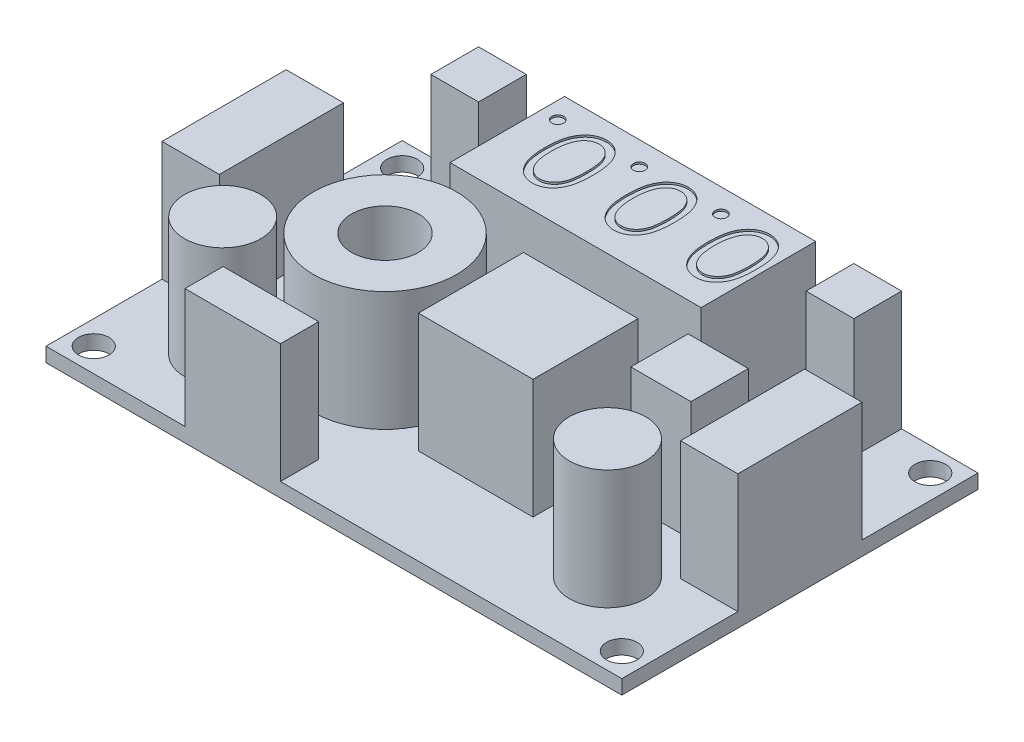
from build123d import *

# Parameters (mm, degrees)
SKETCH_2_W          = 60.3
SKETCH_2_H          = 37.3
EXTRUDE_1_DEPTH     = 1.5
SKETCH_3_R          = 4
SKETCH_3_R_2        = 7.5
SKETCH_3_R_3        = 3.5
SKETCH_3_W          = 6
SKETCH_3_H          = 13
SKETCH_3_W_2        = 10
SKETCH_3_H_2        = 4
SKETCH_3_W_3        = 12
SKETCH_3_H_3        = 11
SKETCH_3_W_4        = 5
SKETCH_3_H_4        = 5
SKETCH_3_W_5        = 26.3
SKETCH_3_H_5        = 12
SKETCH_3_W_6        = 6.3
SKETCH_3_H_6        = 6
EXTRUDE_2_DEPTH     = 12.5
SKETCH_3_2_R        = 4
SKETCH_3_2_R_2      = 7.5
SKETCH_3_2_R_3      = 3.5
SKETCH_3_2_W        = 6
SKETCH_3_2_H        = 13
SKETCH_3_2_W_2      = 10
SKETCH_3_2_H_2      = 4
SKETCH_3_2_W_3      = 12
SKETCH_3_2_H_3      = 11
SKETCH_3_2_W_4      = 5
SKETCH_3_2_H_4      = 5
SKETCH_3_2_W_5      = 26.3
SKETCH_3_2_H_5      = 12
SKETCH_3_2_W_6      = 6.3
SKETCH_3_2_H_6      = 6
EXTRUDE_3_DEPTH     = 8
CUT_EXTRUDE_1_DEPTH = 0.2
SKETCH_6_R          = 1.6
CUT_EXTRUDE_2_DEPTH = 38.591155958


with BuildPart() as part:
    # 스케치2 → 보스-돌출1 (new body)
    with BuildSketch(Plane(origin=(0, 0, 0), x_dir=(1, 0, 0), z_dir=(0, 1, 0))):
        Rectangle(SKETCH_2_W, SKETCH_2_H)
    extrude(amount=EXTRUDE_1_DEPTH)

    # 스케치3 → 보스-돌출2 (add)
    # profile 1 of 11: a face of its own
    with BuildSketch(Plane(origin=(0, 1.5, 0), x_dir=(1, 0, 0), z_dir=(0, 1, 0))):
        with Locations(Location((-20.15, -10.15, 0), (0, 0, 270))):
            Circle(SKETCH_3_R)
    # profile 2 of 11: a face of its own
    with BuildSketch(Plane(origin=(0, 1.5, 0), x_dir=(1, 0, 0), z_dir=(0, 1, 0))):
        with Locations(Location((20.15, -10.15, 0), (0, 0, 270))):
            Circle(SKETCH_3_R)
    # profile 3 of 11: a face of its own
    with BuildSketch(Plane(origin=(0, 1.5, 0), x_dir=(1, 0, 0), z_dir=(0, 1, 0))):
        with Locations(Location((-10.15, -3.15, 0), (0, 0, 270))):
            Circle(SKETCH_3_R_2)
        with Locations(Location((-10.15, -3.15, 0), (0, 0, 270))):
            Circle(SKETCH_3_R_3, mode=Mode.SUBTRACT)
    # profile 4 of 11: a face of its own
    with BuildSketch(Plane(origin=(0, 1.5, 0), x_dir=(1, 0, 0), z_dir=(0, 1, 0))):
        with Locations((-27.15, 0)):
            Rectangle(SKETCH_3_W, SKETCH_3_H)
    # profile 5 of 11: a face of its own
    with BuildSketch(Plane(origin=(0, 1.5, 0), x_dir=(1, 0, 0), z_dir=(0, 1, 0))):
        with Locations((27.15, 0)):
            Rectangle(SKETCH_3_W, SKETCH_3_H)
    # profile 6 of 11: a face of its own
    with BuildSketch(Plane(origin=(0, 1.5, 0), x_dir=(1, 0, 0), z_dir=(0, 1, 0))):
        with Locations((-10.600792866, -16.65)):
            Rectangle(SKETCH_3_W_2, SKETCH_3_H_2)
    # profile 7 of 11: a face of its own
    with BuildSketch(Plane(origin=(0, 1.5, 0), x_dir=(1, 0, 0), z_dir=(0, 1, 0))):
        with Locations((4.85, -3.15)):
            Rectangle(SKETCH_3_W_3, SKETCH_3_H_3)
    # profile 8 of 11: a face of its own
    with BuildSketch(Plane(origin=(0, 1.5, 0), x_dir=(1, 0, 0), z_dir=(0, 1, 0))):
        with Locations((-19.65, 16.15)):
            Rectangle(SKETCH_3_W_4, SKETCH_3_H_4)
    # profile 9 of 11: a face of its own
    with BuildSketch(Plane(origin=(0, 1.5, 0), x_dir=(1, 0, 0), z_dir=(0, 1, 0))):
        with Locations((19.65, 16.15)):
            Rectangle(SKETCH_3_W_4, SKETCH_3_H_4)
    # profile 10 of 11: a face of its own
    with BuildSketch(Plane(origin=(0, 1.5, 0), x_dir=(1, 0, 0), z_dir=(0, 1, 0))):
        with Locations((0, 12.65)):
            Rectangle(SKETCH_3_W_5, SKETCH_3_H_5)
    # profile 11 of 11: a face of its own
    with BuildSketch(Plane(origin=(0, 1.5, 0), x_dir=(1, 0, 0), z_dir=(0, 1, 0))):
        with Locations((18, 0.591539158)):
            Rectangle(SKETCH_3_W_6, SKETCH_3_H_6)
    extrude(amount=EXTRUDE_2_DEPTH)

    # 스케치3<2> → 보스-돌출3 (add)
    # profile 1 of 11: a face of its own
    with BuildSketch(Plane(origin=(0, 1.5, 0), x_dir=(1, 0, 0), z_dir=(0, 1, 0))):
        with Locations(Location((-20.15, -10.15, 0), (0, 0, 270))):
            Circle(SKETCH_3_2_R)
    # profile 2 of 11: a face of its own
    with BuildSketch(Plane(origin=(0, 1.5, 0), x_dir=(1, 0, 0), z_dir=(0, 1, 0))):
        with Locations(Location((20.15, -10.15, 0), (0, 0, 270))):
            Circle(SKETCH_3_2_R)
    # profile 3 of 11: a face of its own
    with BuildSketch(Plane(origin=(0, 1.5, 0), x_dir=(1, 0, 0), z_dir=(0, 1, 0))):
        with Locations(Location((-10.15, -3.15, 0), (0, 0, 270))):
            Circle(SKETCH_3_2_R_2)
        with Locations(Location((-10.15, -3.15, 0), (0, 0, 270))):
            Circle(SKETCH_3_2_R_3, mode=Mode.SUBTRACT)
    # profile 4 of 11: a face of its own
    with BuildSketch(Plane(origin=(0, 1.5, 0), x_dir=(1, 0, 0), z_dir=(0, 1, 0))):
        with Locations((-27.15, 0)):
            Rectangle(SKETCH_3_2_W, SKETCH_3_2_H)
    # profile 5 of 11: a face of its own
    with BuildSketch(Plane(origin=(0, 1.5, 0), x_dir=(1, 0, 0), z_dir=(0, 1, 0))):
        with Locations((27.15, 0)):
            Rectangle(SKETCH_3_2_W, SKETCH_3_2_H)
    # profile 6 of 11: a face of its own
    with BuildSketch(Plane(origin=(0, 1.5, 0), x_dir=(1, 0, 0), z_dir=(0, 1, 0))):
        with Locations((-10.600792866, -16.65)):
            Rectangle(SKETCH_3_2_W_2, SKETCH_3_2_H_2)
    # profile 7 of 11: a face of its own
    with BuildSketch(Plane(origin=(0, 1.5, 0), x_dir=(1, 0, 0), z_dir=(0, 1, 0))):
        with Locations((4.85, -3.15)):
            Rectangle(SKETCH_3_2_W_3, SKETCH_3_2_H_3)
    # profile 8 of 11: a face of its own
    with BuildSketch(Plane(origin=(0, 1.5, 0), x_dir=(1, 0, 0), z_dir=(0, 1, 0))):
        with Locations((-19.65, 16.15)):
            Rectangle(SKETCH_3_2_W_4, SKETCH_3_2_H_4)
    # profile 9 of 11: a face of its own
    with BuildSketch(Plane(origin=(0, 1.5, 0), x_dir=(1, 0, 0), z_dir=(0, 1, 0))):
        with Locations((19.65, 16.15)):
            Rectangle(SKETCH_3_2_W_4, SKETCH_3_2_H_4)
    # profile 10 of 11: a face of its own
    with BuildSketch(Plane(origin=(0, 1.5, 0), x_dir=(1, 0, 0), z_dir=(0, 1, 0))):
        with Locations((0, 12.65)):
            Rectangle(SKETCH_3_2_W_5, SKETCH_3_2_H_5)
    # profile 11 of 11: a face of its own
    with BuildSketch(Plane(origin=(0, 1.5, 0), x_dir=(1, 0, 0), z_dir=(0, 1, 0))):
        with Locations((18, 0.591539158)):
            Rectangle(SKETCH_3_2_W_6, SKETCH_3_2_H_6)
    extrude(amount=EXTRUDE_3_DEPTH)

    # 스케치5 → 컷-돌출1 (cut)
    # profile 1 of 6: a face of its own
    with BuildSketch(Plane(origin=(0, 14, 0), x_dir=(1, 0, 0), z_dir=(0, 1, 0))):
        with BuildLine():
            add(Edge.make_bspline(
                [(-11.397435897, 15.567123363), (-11.438718733, 15.569493808), (-11.519173103, 15.574113469), (-11.635673463, 15.608065675), (-11.742133764, 15.66535282), (-11.836376857, 15.744065944), (-11.914704943, 15.838038705), (-11.972651259, 15.944228568), (-12.008159739, 16.061066679), (-12.012548898, 16.142681621), (-12.014797009, 16.184484474)],
                knots=[0, 0, 0, 0, 1.020591893, 1.988988293, 2.974634352, 3.991697318, 5.008760285, 5.983632262, 6.967224335, 8, 8, 8, 8], degree=3))
            add(Edge.make_bspline(
                [(-12.014797009, 16.184484474), (-12.012466937, 16.225289178), (-12.007864137, 16.305894365), (-11.972634617, 16.42174672), (-11.91477841, 16.528057141), (-11.835880878, 16.621807527), (-11.742703221, 16.702415061), (-11.63533597, 16.758907344), (-11.519473472, 16.795347589), (-11.438772871, 16.799644562), (-11.397435897, 16.801845585)],
                knots=[0, 0, 0, 0, 1.010056097, 1.99525427, 2.971718109, 3.990441831, 5.01702829, 6.004283803, 6.977741589, 8, 8, 8, 8], degree=3))
            add(Edge.make_bspline(
                [(-11.397435897, 16.801845585), (-11.356128673, 16.799561654), (-11.275011747, 16.795076592), (-11.15871567, 16.759631815), (-11.051998863, 16.701863814), (-10.958796985, 16.621953), (-10.88053367, 16.527568928), (-10.819991473, 16.422470523), (-10.787572789, 16.305559314), (-10.78259768, 16.225223181), (-10.780074786, 16.184484474)],
                knots=[0, 0, 0, 0, 1.021821805, 2.006599202, 2.982645994, 4.008793999, 5.027082625, 6.009034913, 6.990375297, 8, 8, 8, 8], degree=3))
            add(Edge.make_bspline(
                [(-10.780074786, 16.184484474), (-10.782522528, 16.142749951), (-10.787293308, 16.061407139), (-10.819976727, 15.943505435), (-10.880607272, 15.838527428), (-10.958302648, 15.743921608), (-11.052562566, 15.665895393), (-11.158384596, 15.607351229), (-11.275307417, 15.574380603), (-11.356181615, 15.569574816), (-11.397435897, 15.567123363)],
                knots=[0, 0, 0, 0, 1.032329927, 2.012066096, 2.992413168, 4.009037178, 5.025661188, 6.000112418, 6.979848586, 8, 8, 8, 8], degree=3))
        make_face()
    # profile 2 of 6: a face of its own
    with BuildSketch(Plane(origin=(0, 14, 0), x_dir=(1, 0, 0), z_dir=(0, 1, 0))):
        with BuildLine():
            add(Edge.make_bspline(
                [(-4.511485043, 13.005668368), (-4.512179348, 12.886928898), (-4.513528045, 12.656275764), (-4.52853187, 12.320181606), (-4.553456343, 12.004882325), (-4.587613789, 11.710362842), (-4.629180824, 11.436547086), (-4.684670348, 11.184166923), (-4.747773855, 10.952053844), (-4.820910734, 10.739452331), (-4.903431896, 10.543493358), (-4.99326163, 10.360570013), (-5.093903041, 10.190900808), (-5.199821224, 10.031985876), (-5.31472312, 9.885424488), (-5.438209155, 9.751875318), (-5.569191654, 9.629268823), (-5.708290392, 9.51962111), (-5.854179582, 9.424077754), (-6.002543632, 9.337469863), (-6.15761419, 9.268960632), (-6.315566354, 9.210377348), (-6.477672711, 9.163971471), (-6.644003878, 9.13169254), (-6.814709112, 9.111498155), (-6.929920357, 9.109559528), (-6.988349693, 9.108576354)],
                knots=[0, 0, 0, 0, 1.64625301, 3.197870201, 4.6634513, 6.030635694, 7.308242971, 8.501545196, 9.611429483, 10.641742253, 11.616230371, 12.55791849, 13.464870342, 14.34944951, 15.20427819, 16.044004467, 16.869007726, 17.689551165, 18.496129964, 19.285613293, 20.0683943, 20.843080271, 21.620342827, 22.403213977, 23.190190624, 24, 24, 24, 24], degree=3))
            add(Edge.make_bspline(
                [(-6.988349693, 9.108576354), (-7.047296696, 9.109393917), (-7.164580485, 9.111020578), (-7.337353715, 9.133916813), (-7.507117531, 9.163469646), (-7.671296279, 9.210867523), (-7.832994264, 9.26758523), (-7.988190382, 9.342423343), (-8.142363877, 9.423815603), (-8.288510853, 9.523107313), (-8.430997914, 9.632840993), (-8.564564657, 9.757416773), (-8.692625405, 9.893387006), (-8.810343354, 10.043784224), (-8.92276373, 10.206302392), (-9.025618944, 10.382303882), (-9.121048196, 10.571398649), (-9.210845303, 10.772710077), (-9.289370501, 10.991615508), (-9.35918568, 11.226749571), (-9.416411032, 11.480241516), (-9.463735392, 11.750679235), (-9.500468104, 12.039402471), (-9.52720155, 12.345826237), (-9.541327853, 12.670142238), (-9.543987644, 12.891879755), (-9.545352564, 13.005668368)],
                knots=[0, 0, 0, 0, 0.810910589, 1.61342667, 2.396193133, 3.181089899, 3.963115317, 4.752255436, 5.550715454, 6.36105385, 7.181178335, 8.024612154, 8.872680183, 9.750181803, 10.651284446, 11.591556747, 12.554036451, 13.566402641, 14.62422919, 15.753422176, 16.94128843, 18.199818041, 19.531985927, 20.947085226, 22.433341622, 24, 24, 24, 24], degree=3))
            add(Edge.make_bspline(
                [(-9.545352564, 13.005668368), (-9.543955916, 13.118959227), (-9.541228512, 13.340195966), (-9.527523045, 13.663073753), (-9.499751468, 13.967825443), (-9.465902937, 14.254892564), (-9.417099978, 14.523899873), (-9.362767702, 14.776292038), (-9.293463834, 15.009697534), (-9.216801235, 15.226726558), (-9.128253594, 15.427185214), (-9.033543039, 15.615499459), (-8.92915243, 15.790502101), (-8.818889194, 15.954050393), (-8.69894261, 16.103157767), (-8.572614906, 16.24064899), (-8.437752358, 16.365441205), (-8.294531811, 16.476470544), (-8.147003483, 16.57651021), (-7.992799932, 16.660804671), (-7.83553092, 16.734292239), (-7.673560648, 16.793367649), (-7.507921951, 16.840066993), (-7.338018337, 16.871857331), (-7.164557379, 16.894265516), (-7.047288967, 16.895968364), (-6.988349693, 16.896824218)],
                knots=[0, 0, 0, 0, 1.561431216, 3.049195289, 4.452146966, 5.778046447, 7.031138842, 8.218704273, 9.334037798, 10.384210803, 11.388620812, 12.352076869, 13.287433199, 14.19507451, 15.06813243, 15.922055533, 16.766344942, 17.596869952, 18.417486629, 19.220035357, 20.016159057, 20.807716045, 21.59340902, 22.384936649, 23.188266813, 24, 24, 24, 24], degree=3))
            add(Edge.make_bspline(
                [(-6.988349693, 16.896824218), (-6.929922394, 16.895832331), (-6.814715164, 16.893876523), (-6.643980515, 16.873807995), (-6.47789052, 16.841082987), (-6.316113144, 16.796642595), (-6.158317344, 16.740161468), (-6.006048736, 16.668319654), (-5.857296952, 16.584994007), (-5.712738563, 16.490196696), (-5.575137093, 16.381556838), (-5.443672279, 16.261421803), (-5.321785121, 16.126695577), (-5.207675633, 15.979528498), (-5.100878616, 15.820213524), (-5.000663394, 15.649245411), (-4.911107222, 15.464540078), (-4.82671499, 15.267517329), (-4.752322593, 15.053353675), (-4.687364526, 14.820445179), (-4.632598964, 14.567203187), (-4.58897743, 14.293615578), (-4.553241666, 14.000105883), (-4.528556442, 13.68620638), (-4.513535547, 13.352589412), (-4.512181017, 13.123418955), (-4.511485043, 13.005668368)],
                knots=[0, 0, 0, 0, 0.810976328, 1.599087026, 2.383086309, 3.159618043, 3.926613167, 4.707144544, 5.494386734, 6.292609454, 7.104690378, 7.92621526, 8.762510248, 9.62398222, 10.509836085, 11.424023232, 12.373226806, 13.358118208, 14.398657954, 15.5185989, 16.713620699, 17.994156382, 19.364120462, 20.818119981, 22.365111093, 24, 24, 24, 24], degree=3))
        make_face()
        with BuildLine():
            add(Edge.make_bspline(
                [(-5.17633547, 13.002700286), (-5.176593844, 13.101651303), (-5.177095296, 13.293695797), (-5.189816267, 13.572276274), (-5.20752256, 13.832544853), (-5.229798103, 14.074399947), (-5.263158868, 14.296996307), (-5.301008783, 14.50125925), (-5.346407151, 14.686811016), (-5.400387401, 14.855272018), (-5.461872912, 15.009031402), (-5.528897572, 15.152174703), (-5.601499765, 15.286443046), (-5.6813452, 15.411351992), (-5.769577835, 15.526203894), (-5.864228287, 15.631544221), (-5.965846918, 15.726944058), (-6.106486901, 15.840164333), (-6.291254673, 15.958540207), (-6.525244582, 16.060354708), (-6.76578574, 16.124752199), (-6.929096731, 16.132918903), (-7.01061031, 16.136995158)],
                knots=[0, 0, 0, 0, 1.459193451, 2.832007961, 4.111736495, 5.306635028, 6.412683014, 7.430020708, 8.369596877, 9.227877302, 10.036669781, 10.810175692, 11.557788084, 12.286326232, 12.994037279, 13.69140682, 14.37267704, 15.047194847, 16.352618509, 17.594157723, 18.799169539, 20, 20, 20, 20], degree=3))
            add(Edge.make_bspline(
                [(-7.01061031, 16.136995158), (-7.092591953, 16.13342084), (-7.256264433, 16.126284884), (-7.496641864, 16.064005072), (-7.72807076, 15.962757874), (-7.910711992, 15.847085351), (-8.04927661, 15.736221351), (-8.148592504, 15.641808112), (-8.239738209, 15.536062328), (-8.326187906, 15.421977114), (-8.405476105, 15.297363236), (-8.477576464, 15.162822581), (-8.543369535, 15.017980785), (-8.580853685, 14.916868175), (-8.600018363, 14.865171907)],
                knots=[0, 0, 0, 0, 1.353621445, 2.702441307, 4.075953605, 5.516772412, 6.261413105, 7.007624062, 7.778524365, 8.566925914, 9.372323995, 10.217594641, 11.088702136, 12, 12, 12, 12], degree=3))
            add(Edge.make_bspline(
                [(-8.600018363, 14.865171907), (-8.622352938, 14.799068959), (-8.667701704, 14.664851625), (-8.726146626, 14.456648561), (-8.772174388, 14.238202711), (-8.813583512, 14.010819547), (-8.84184748, 13.77282218), (-8.864597018, 13.524947), (-8.877996972, 13.267007117), (-8.879658029, 13.091757719), (-8.880502137, 13.002700286)],
                knots=[0, 0, 0, 0, 0.884706709, 1.796334032, 2.740027952, 3.714592787, 4.726048262, 5.777819803, 6.87074269, 8, 8, 8, 8], degree=3))
            add(Edge.make_bspline(
                [(-8.880502137, 13.002700286), (-8.879571176, 12.913644767), (-8.877749792, 12.739411585), (-8.865783136, 12.484508282), (-8.846553716, 12.241982008), (-8.820527114, 12.011612753), (-8.784798102, 11.793810539), (-8.741891091, 11.588263725), (-8.691587622, 11.395027623), (-8.633887774, 11.213604239), (-8.568861774, 11.044644461), (-8.497024343, 10.887784576), (-8.420375131, 10.742178564), (-8.337068168, 10.608294758), (-8.248282107, 10.485351939), (-8.150828953, 10.376180172), (-8.050898853, 10.275468557), (-7.908777103, 10.162563418), (-7.724227713, 10.046534744), (-7.493001864, 9.942662738), (-7.253693081, 9.881188482), (-7.091579476, 9.872663365), (-7.01061031, 9.868405414)],
                knots=[0, 0, 0, 0, 1.313528337, 2.569860077, 3.762944266, 4.901481389, 5.988248151, 7.017139294, 7.997571128, 8.932104357, 9.823695246, 10.66607014, 11.475539426, 12.248954257, 12.990316782, 13.708962568, 14.405488541, 15.08007697, 16.381737273, 17.610043218, 18.806313575, 20, 20, 20, 20], degree=3))
            add(Edge.make_bspline(
                [(-7.01061031, 9.868405414), (-6.928656998, 9.872668403), (-6.764601074, 9.881202146), (-6.522788848, 9.942445847), (-6.290178777, 10.045795973), (-6.106018292, 10.162706896), (-5.965897328, 10.275030083), (-5.866184747, 10.370895547), (-5.772082094, 10.475250722), (-5.684272141, 10.589581882), (-5.604913867, 10.714252649), (-5.53142926, 10.847547626), (-5.464939343, 10.990478291), (-5.403221748, 11.144152694), (-5.349814258, 11.312890509), (-5.301794699, 11.49840527), (-5.264730824, 11.703996623), (-5.231821361, 11.927638296), (-5.206945548, 12.169780938), (-5.18993967, 12.430665636), (-5.177056659, 12.710217225), (-5.176580681, 12.903253253), (-5.17633547, 13.002700286)],
                knots=[0, 0, 0, 0, 1.207779899, 2.417760083, 3.652287919, 4.947299644, 5.621638849, 6.297435916, 6.984320042, 7.691843698, 8.42018894, 9.161205785, 9.934506883, 10.743085206, 11.601138371, 12.542248028, 13.566483018, 14.679455109, 15.87477181, 17.154161492, 18.533899613, 20, 20, 20, 20], degree=3))
        make_face(mode=Mode.SUBTRACT)
    # profile 3 of 6: a face of its own
    with BuildSketch(Plane(origin=(0, 14, 0), x_dir=(1, 0, 0), z_dir=(0, 1, 0))):
        with BuildLine():
            add(Edge.make_bspline(
                [(-2.849358974, 15.567123363), (-2.89064181, 15.569493808), (-2.97109618, 15.574113469), (-3.08759654, 15.608065675), (-3.194056841, 15.66535282), (-3.288299934, 15.744065944), (-3.36662802, 15.838038705), (-3.424574335, 15.944228568), (-3.460082816, 16.061066679), (-3.464471975, 16.142681621), (-3.466720085, 16.184484474)],
                knots=[0, 0, 0, 0, 1.020591893, 1.988988293, 2.974634352, 3.991697318, 5.008760285, 5.983632262, 6.967224335, 8, 8, 8, 8], degree=3))
            add(Edge.make_bspline(
                [(-3.466720085, 16.184484474), (-3.464390014, 16.225289178), (-3.459787214, 16.305894365), (-3.424557694, 16.42174672), (-3.366701487, 16.528057141), (-3.287803955, 16.621807527), (-3.194626298, 16.702415061), (-3.087259047, 16.758907344), (-2.971396549, 16.795347589), (-2.890695948, 16.799644562), (-2.849358974, 16.801845585)],
                knots=[0, 0, 0, 0, 1.010056097, 1.99525427, 2.971718109, 3.990441831, 5.01702829, 6.004283803, 6.977741589, 8, 8, 8, 8], degree=3))
            add(Edge.make_bspline(
                [(-2.849358974, 16.801845585), (-2.80805175, 16.799561654), (-2.726934824, 16.795076592), (-2.610638747, 16.759631815), (-2.503921939, 16.701863814), (-2.410720062, 16.621953), (-2.332456747, 16.527568928), (-2.27191455, 16.422470523), (-2.239495866, 16.305559314), (-2.234520757, 16.225223181), (-2.231997863, 16.184484474)],
                knots=[0, 0, 0, 0, 1.021821805, 2.006599202, 2.982645994, 4.008793999, 5.027082625, 6.009034913, 6.990375297, 8, 8, 8, 8], degree=3))
            add(Edge.make_bspline(
                [(-2.231997863, 16.184484474), (-2.234445605, 16.142749951), (-2.239216385, 16.061407139), (-2.271899804, 15.943505435), (-2.332530349, 15.838527428), (-2.410225725, 15.743921608), (-2.504485643, 15.665895393), (-2.610307673, 15.607351229), (-2.727230494, 15.574380603), (-2.808104692, 15.569574816), (-2.849358974, 15.567123363)],
                knots=[0, 0, 0, 0, 1.032329927, 2.012066096, 2.992413168, 4.009037178, 5.025661188, 6.000112418, 6.979848586, 8, 8, 8, 8], degree=3))
        make_face()
    # profile 4 of 6: a face of its own
    with BuildSketch(Plane(origin=(0, 14, 0), x_dir=(1, 0, 0), z_dir=(0, 1, 0))):
        with BuildLine():
            add(Edge.make_bspline(
                [(4.03659188, 13.005668368), (4.035897575, 12.886928898), (4.034548878, 12.656275764), (4.019545053, 12.320181606), (3.99462058, 12.004882325), (3.960463134, 11.710362842), (3.918896099, 11.436547086), (3.863406575, 11.184166923), (3.800303068, 10.952053844), (3.727166189, 10.739452331), (3.644645027, 10.543493358), (3.554815293, 10.360570013), (3.454173882, 10.190900808), (3.348255699, 10.031985876), (3.233353803, 9.885424488), (3.109867768, 9.751875318), (2.978885269, 9.629268823), (2.839786531, 9.51962111), (2.693897341, 9.424077754), (2.545533291, 9.337469863), (2.390462733, 9.268960632), (2.232510569, 9.210377348), (2.070404212, 9.163971471), (1.904073045, 9.13169254), (1.733367811, 9.111498155), (1.618156566, 9.109559528), (1.55972723, 9.108576354)],
                knots=[0, 0, 0, 0, 1.64625301, 3.197870201, 4.6634513, 6.030635694, 7.308242971, 8.501545196, 9.611429483, 10.641742253, 11.616230371, 12.55791849, 13.464870342, 14.34944951, 15.20427819, 16.044004467, 16.869007726, 17.689551165, 18.496129964, 19.285613293, 20.0683943, 20.843080271, 21.620342827, 22.403213977, 23.190190624, 24, 24, 24, 24], degree=3))
            add(Edge.make_bspline(
                [(1.55972723, 9.108576354), (1.500780227, 9.109393917), (1.383496438, 9.111020578), (1.210723208, 9.133916813), (1.040959392, 9.163469646), (0.876780644, 9.210867523), (0.715082659, 9.26758523), (0.559886541, 9.342423343), (0.405713046, 9.423815603), (0.25956607, 9.523107313), (0.117079009, 9.632840993), (-0.016487734, 9.757416773), (-0.144548482, 9.893387006), (-0.262266431, 10.043784224), (-0.374686807, 10.206302392), (-0.477542021, 10.382303882), (-0.572971273, 10.571398649), (-0.66276838, 10.772710077), (-0.741293578, 10.991615508), (-0.811108757, 11.226749571), (-0.868334109, 11.480241516), (-0.915658469, 11.750679235), (-0.952391181, 12.039402471), (-0.979124627, 12.345826237), (-0.99325093, 12.670142238), (-0.995910721, 12.891879755), (-0.997275641, 13.005668368)],
                knots=[0, 0, 0, 0, 0.810910589, 1.61342667, 2.396193133, 3.181089899, 3.963115317, 4.752255436, 5.550715454, 6.36105385, 7.181178335, 8.024612154, 8.872680183, 9.750181803, 10.651284446, 11.591556747, 12.554036451, 13.566402641, 14.62422919, 15.753422176, 16.94128843, 18.199818041, 19.531985927, 20.947085226, 22.433341622, 24, 24, 24, 24], degree=3))
            add(Edge.make_bspline(
                [(-0.997275641, 13.005668368), (-0.995878993, 13.118959227), (-0.993151589, 13.340195966), (-0.979446122, 13.663073753), (-0.951674545, 13.967825443), (-0.917826014, 14.254892564), (-0.869023055, 14.523899873), (-0.814690779, 14.776292038), (-0.745386911, 15.009697534), (-0.668724312, 15.226726558), (-0.580176671, 15.427185214), (-0.485466116, 15.615499459), (-0.381075507, 15.790502101), (-0.270812271, 15.954050393), (-0.150865687, 16.103157767), (-0.024537983, 16.24064899), (0.110324565, 16.365441205), (0.253545112, 16.476470544), (0.401073441, 16.57651021), (0.555276991, 16.660804671), (0.712546003, 16.734292239), (0.874516275, 16.793367649), (1.040154972, 16.840066993), (1.210058586, 16.871857331), (1.383519544, 16.894265516), (1.500787956, 16.895968364), (1.55972723, 16.896824218)],
                knots=[0, 0, 0, 0, 1.561431216, 3.049195289, 4.452146966, 5.778046447, 7.031138842, 8.218704273, 9.334037798, 10.384210803, 11.388620812, 12.352076869, 13.287433199, 14.19507451, 15.06813243, 15.922055533, 16.766344942, 17.596869952, 18.417486629, 19.220035357, 20.016159057, 20.807716045, 21.59340902, 22.384936649, 23.188266813, 24, 24, 24, 24], degree=3))
            add(Edge.make_bspline(
                [(1.55972723, 16.896824218), (1.618154529, 16.895832331), (1.733361759, 16.893876523), (1.904096408, 16.873807995), (2.070186403, 16.841082987), (2.231963779, 16.796642595), (2.389759579, 16.740161468), (2.542028187, 16.668319654), (2.690779971, 16.584994007), (2.83533836, 16.490196696), (2.97293983, 16.381556838), (3.104404644, 16.261421803), (3.226291802, 16.126695577), (3.34040129, 15.979528498), (3.447198307, 15.820213524), (3.547413529, 15.649245411), (3.636969701, 15.464540078), (3.721361933, 15.267517329), (3.79575433, 15.053353675), (3.860712398, 14.820445179), (3.915477959, 14.567203187), (3.959099493, 14.293615578), (3.994835257, 14.000105883), (4.019520482, 13.68620638), (4.034541376, 13.352589412), (4.035895906, 13.123418955), (4.03659188, 13.005668368)],
                knots=[0, 0, 0, 0, 0.810976328, 1.599087026, 2.383086309, 3.159618043, 3.926613167, 4.707144544, 5.494386734, 6.292609454, 7.104690378, 7.92621526, 8.762510248, 9.62398222, 10.509836085, 11.424023232, 12.373226806, 13.358118208, 14.398657954, 15.5185989, 16.713620699, 17.994156382, 19.364120462, 20.818119981, 22.365111093, 24, 24, 24, 24], degree=3))
        make_face()
        with BuildLine():
            add(Edge.make_bspline(
                [(3.371741453, 13.002700286), (3.371483079, 13.101651303), (3.370981627, 13.293695797), (3.358260656, 13.572276274), (3.340554363, 13.832544853), (3.31827882, 14.074399947), (3.284918056, 14.296996307), (3.247068141, 14.50125925), (3.201669772, 14.686811016), (3.147689522, 14.855272018), (3.086204011, 15.009031402), (3.019179351, 15.152174703), (2.946577158, 15.286443046), (2.866731723, 15.411351992), (2.778499088, 15.526203894), (2.683848636, 15.631544221), (2.582230005, 15.726944058), (2.441590022, 15.840164333), (2.25682225, 15.958540207), (2.022832342, 16.060354708), (1.782291183, 16.124752199), (1.618980192, 16.132918903), (1.537466613, 16.136995158)],
                knots=[0, 0, 0, 0, 1.459193451, 2.832007961, 4.111736495, 5.306635028, 6.412683014, 7.430020708, 8.369596877, 9.227877302, 10.036669781, 10.810175692, 11.557788084, 12.286326232, 12.994037279, 13.69140682, 14.37267704, 15.047194847, 16.352618509, 17.594157723, 18.799169539, 20, 20, 20, 20], degree=3))
            add(Edge.make_bspline(
                [(1.537466613, 16.136995158), (1.45548497, 16.13342084), (1.29181249, 16.126284884), (1.051435059, 16.064005072), (0.820006163, 15.962757874), (0.637364932, 15.847085351), (0.498800313, 15.736221351), (0.399484419, 15.641808112), (0.308338714, 15.536062328), (0.221889017, 15.421977114), (0.142600818, 15.297363236), (0.070500459, 15.162822581), (0.004707388, 15.017980785), (-0.032776761, 14.916868175), (-0.05194144, 14.865171907)],
                knots=[0, 0, 0, 0, 1.353621445, 2.702441307, 4.075953605, 5.516772412, 6.261413105, 7.007624062, 7.778524365, 8.566925914, 9.372323995, 10.217594641, 11.088702136, 12, 12, 12, 12], degree=3))
            add(Edge.make_bspline(
                [(-0.05194144, 14.865171907), (-0.074276015, 14.799068959), (-0.119624781, 14.664851625), (-0.178069703, 14.456648561), (-0.224097465, 14.238202711), (-0.265506589, 14.010819547), (-0.293770557, 13.77282218), (-0.316520095, 13.524947), (-0.329920049, 13.267007117), (-0.331581106, 13.091757719), (-0.332425214, 13.002700286)],
                knots=[0, 0, 0, 0, 0.884706709, 1.796334032, 2.740027952, 3.714592787, 4.726048262, 5.777819803, 6.87074269, 8, 8, 8, 8], degree=3))
            add(Edge.make_bspline(
                [(-0.332425214, 13.002700286), (-0.331494253, 12.913644767), (-0.329672869, 12.739411585), (-0.317706213, 12.484508282), (-0.298476792, 12.241982008), (-0.272450191, 12.011612753), (-0.236721179, 11.793810539), (-0.193814168, 11.588263725), (-0.143510699, 11.395027623), (-0.085810851, 11.213604239), (-0.020784851, 11.044644461), (0.05105258, 10.887784576), (0.127701792, 10.742178564), (0.211008755, 10.608294758), (0.299794816, 10.485351939), (0.39724797, 10.376180172), (0.49717807, 10.275468557), (0.63929982, 10.162563418), (0.82384921, 10.046534744), (1.055075059, 9.942662738), (1.294383843, 9.881188482), (1.456497447, 9.872663365), (1.537466613, 9.868405414)],
                knots=[0, 0, 0, 0, 1.313528337, 2.569860077, 3.762944266, 4.901481389, 5.988248151, 7.017139294, 7.997571128, 8.932104357, 9.823695246, 10.66607014, 11.475539426, 12.248954257, 12.990316782, 13.708962568, 14.405488541, 15.08007697, 16.381737273, 17.610043218, 18.806313575, 20, 20, 20, 20], degree=3))
            add(Edge.make_bspline(
                [(1.537466613, 9.868405414), (1.619419925, 9.872668403), (1.783475849, 9.881202146), (2.025288075, 9.942445847), (2.257898146, 10.045795973), (2.442058631, 10.162706896), (2.582179595, 10.275030083), (2.681892176, 10.370895547), (2.775994829, 10.475250722), (2.863804782, 10.589581882), (2.943163056, 10.714252649), (3.016647663, 10.847547626), (3.08313758, 10.990478291), (3.144855175, 11.144152694), (3.198262665, 11.312890509), (3.246282224, 11.49840527), (3.283346099, 11.703996623), (3.316255562, 11.927638296), (3.341131375, 12.169780938), (3.358137253, 12.430665636), (3.371020264, 12.710217225), (3.371496242, 12.903253253), (3.371741453, 13.002700286)],
                knots=[0, 0, 0, 0, 1.207779899, 2.417760083, 3.652287919, 4.947299644, 5.621638849, 6.297435916, 6.984320042, 7.691843698, 8.42018894, 9.161205785, 9.934506883, 10.743085206, 11.601138371, 12.542248028, 13.566483018, 14.679455109, 15.87477181, 17.154161492, 18.533899613, 20, 20, 20, 20], degree=3))
        make_face(mode=Mode.SUBTRACT)
    # profile 5 of 6: a face of its own
    with BuildSketch(Plane(origin=(0, 14, 0), x_dir=(1, 0, 0), z_dir=(0, 1, 0))):
        with BuildLine():
            add(Edge.make_bspline(
                [(5.698717949, 15.567123363), (5.657435113, 15.569493808), (5.576980743, 15.574113469), (5.460480383, 15.608065675), (5.354020082, 15.66535282), (5.259776989, 15.744065944), (5.181448903, 15.838038705), (5.123502588, 15.944228568), (5.087994107, 16.061066679), (5.083604948, 16.142681621), (5.081356838, 16.184484474)],
                knots=[0, 0, 0, 0, 1.020591893, 1.988988293, 2.974634352, 3.991697318, 5.008760285, 5.983632262, 6.967224335, 8, 8, 8, 8], degree=3))
            add(Edge.make_bspline(
                [(5.081356838, 16.184484474), (5.083686909, 16.225289178), (5.088289709, 16.305894365), (5.12351923, 16.42174672), (5.181375436, 16.528057141), (5.260272968, 16.621807527), (5.353450625, 16.702415061), (5.460817876, 16.758907344), (5.576680374, 16.795347589), (5.657380975, 16.799644562), (5.698717949, 16.801845585)],
                knots=[0, 0, 0, 0, 1.010056097, 1.99525427, 2.971718109, 3.990441831, 5.01702829, 6.004283803, 6.977741589, 8, 8, 8, 8], degree=3))
            add(Edge.make_bspline(
                [(5.698717949, 16.801845585), (5.740025173, 16.799561654), (5.821142099, 16.795076592), (5.937438176, 16.759631815), (6.044154984, 16.701863814), (6.137356861, 16.621953), (6.215620176, 16.527568928), (6.276162373, 16.422470523), (6.308581057, 16.305559314), (6.313556166, 16.225223181), (6.31607906, 16.184484474)],
                knots=[0, 0, 0, 0, 1.021821805, 2.006599202, 2.982645994, 4.008793999, 5.027082625, 6.009034913, 6.990375297, 8, 8, 8, 8], degree=3))
            add(Edge.make_bspline(
                [(6.31607906, 16.184484474), (6.313631318, 16.142749951), (6.308860538, 16.061407139), (6.276177119, 15.943505435), (6.215546574, 15.838527428), (6.137851198, 15.743921608), (6.04359128, 15.665895393), (5.93776925, 15.607351229), (5.820846429, 15.574380603), (5.739972231, 15.569574816), (5.698717949, 15.567123363)],
                knots=[0, 0, 0, 0, 1.032329927, 2.012066096, 2.992413168, 4.009037178, 5.025661188, 6.000112418, 6.979848586, 8, 8, 8, 8], degree=3))
        make_face()
    # profile 6 of 6: a face of its own
    with BuildSketch(Plane(origin=(0, 14, 0), x_dir=(1, 0, 0), z_dir=(0, 1, 0))):
        with BuildLine():
            add(Edge.make_bspline(
                [(12.584668803, 13.005668368), (12.583974498, 12.886928898), (12.582625801, 12.656275764), (12.567621976, 12.320181606), (12.542697503, 12.004882325), (12.508540057, 11.710362842), (12.466973022, 11.436547086), (12.411483498, 11.184166923), (12.348379991, 10.952053844), (12.275243112, 10.739452331), (12.19272195, 10.543493358), (12.102892216, 10.360570013), (12.002250805, 10.190900808), (11.896332622, 10.031985876), (11.781430726, 9.885424488), (11.657944691, 9.751875318), (11.526962192, 9.629268823), (11.387863454, 9.51962111), (11.241974264, 9.424077754), (11.093610214, 9.337469863), (10.938539656, 9.268960632), (10.780587492, 9.210377348), (10.618481135, 9.163971471), (10.452149968, 9.13169254), (10.281444734, 9.111498155), (10.166233489, 9.109559528), (10.107804153, 9.108576354)],
                knots=[0, 0, 0, 0, 1.64625301, 3.197870201, 4.6634513, 6.030635694, 7.308242971, 8.501545196, 9.611429483, 10.641742253, 11.616230371, 12.55791849, 13.464870342, 14.34944951, 15.20427819, 16.044004467, 16.869007726, 17.689551165, 18.496129964, 19.285613293, 20.0683943, 20.843080271, 21.620342827, 22.403213977, 23.190190624, 24, 24, 24, 24], degree=3))
            add(Edge.make_bspline(
                [(10.107804153, 9.108576354), (10.048857151, 9.109393917), (9.931573361, 9.111020578), (9.758800131, 9.133916813), (9.589036315, 9.163469646), (9.424857567, 9.210867523), (9.263159582, 9.26758523), (9.107963464, 9.342423343), (8.953789969, 9.423815603), (8.807642993, 9.523107313), (8.665155932, 9.632840993), (8.531589189, 9.757416773), (8.403528441, 9.893387006), (8.285810493, 10.043784224), (8.173390116, 10.206302392), (8.070534902, 10.382303882), (7.97510565, 10.571398649), (7.885308543, 10.772710077), (7.806783345, 10.991615508), (7.736968166, 11.226749571), (7.679742814, 11.480241516), (7.632418454, 11.750679235), (7.595685743, 12.039402471), (7.568952296, 12.345826237), (7.554825993, 12.670142238), (7.552166202, 12.891879755), (7.550801282, 13.005668368)],
                knots=[0, 0, 0, 0, 0.810910589, 1.61342667, 2.396193133, 3.181089899, 3.963115317, 4.752255436, 5.550715454, 6.36105385, 7.181178335, 8.024612154, 8.872680183, 9.750181803, 10.651284446, 11.591556747, 12.554036451, 13.566402641, 14.62422919, 15.753422176, 16.94128843, 18.199818041, 19.531985927, 20.947085226, 22.433341622, 24, 24, 24, 24], degree=3))
            add(Edge.make_bspline(
                [(7.550801282, 13.005668368), (7.55219793, 13.118959227), (7.554925334, 13.340195966), (7.568630801, 13.663073753), (7.596402378, 13.967825443), (7.630250909, 14.254892564), (7.679053868, 14.523899873), (7.733386144, 14.776292038), (7.802690012, 15.009697534), (7.879352611, 15.226726558), (7.967900252, 15.427185214), (8.062610808, 15.615499459), (8.167001416, 15.790502101), (8.277264652, 15.954050393), (8.397211236, 16.103157767), (8.523538941, 16.24064899), (8.658401488, 16.365441205), (8.801622035, 16.476470544), (8.949150364, 16.57651021), (9.103353914, 16.660804671), (9.260622926, 16.734292239), (9.422593198, 16.793367649), (9.588231895, 16.840066993), (9.758135509, 16.871857331), (9.931596467, 16.894265516), (10.048864879, 16.895968364), (10.107804153, 16.896824218)],
                knots=[0, 0, 0, 0, 1.561431216, 3.049195289, 4.452146966, 5.778046447, 7.031138842, 8.218704273, 9.334037798, 10.384210803, 11.388620812, 12.352076869, 13.287433199, 14.19507451, 15.06813243, 15.922055533, 16.766344942, 17.596869952, 18.417486629, 19.220035357, 20.016159057, 20.807716045, 21.59340902, 22.384936649, 23.188266813, 24, 24, 24, 24], degree=3))
            add(Edge.make_bspline(
                [(10.107804153, 16.896824218), (10.166231452, 16.895832331), (10.281438682, 16.893876523), (10.452173331, 16.873807995), (10.618263326, 16.841082987), (10.780040702, 16.796642595), (10.937836502, 16.740161468), (11.09010511, 16.668319654), (11.238856894, 16.584994007), (11.383415283, 16.490196696), (11.521016753, 16.381556838), (11.652481567, 16.261421803), (11.774368725, 16.126695577), (11.888478213, 15.979528498), (11.99527523, 15.820213524), (12.095490452, 15.649245411), (12.185046624, 15.464540078), (12.269438856, 15.267517329), (12.343831253, 15.053353675), (12.408789321, 14.820445179), (12.463554882, 14.567203187), (12.507176416, 14.293615578), (12.542912181, 14.000105883), (12.567597405, 13.68620638), (12.582618299, 13.352589412), (12.583972829, 13.123418955), (12.584668803, 13.005668368)],
                knots=[0, 0, 0, 0, 0.810976328, 1.599087026, 2.383086309, 3.159618043, 3.926613167, 4.707144544, 5.494386734, 6.292609454, 7.104690378, 7.92621526, 8.762510248, 9.62398222, 10.509836085, 11.424023232, 12.373226806, 13.358118208, 14.398657954, 15.5185989, 16.713620699, 17.994156382, 19.364120462, 20.818119981, 22.365111093, 24, 24, 24, 24], degree=3))
        make_face()
        with BuildLine():
            add(Edge.make_bspline(
                [(11.919818376, 13.002700286), (11.919560003, 13.101651303), (11.91905855, 13.293695797), (11.906337579, 13.572276274), (11.888631286, 13.832544853), (11.866355743, 14.074399947), (11.832994979, 14.296996307), (11.795145064, 14.50125925), (11.749746695, 14.686811016), (11.695766445, 14.855272018), (11.634280934, 15.009031402), (11.567256274, 15.152174703), (11.494654081, 15.286443046), (11.414808646, 15.411351992), (11.326576011, 15.526203894), (11.231925559, 15.631544221), (11.130306928, 15.726944058), (10.989666945, 15.840164333), (10.804899173, 15.958540207), (10.570909265, 16.060354708), (10.330368106, 16.124752199), (10.167057115, 16.132918903), (10.085543536, 16.136995158)],
                knots=[0, 0, 0, 0, 1.459193451, 2.832007961, 4.111736495, 5.306635028, 6.412683014, 7.430020708, 8.369596877, 9.227877302, 10.036669781, 10.810175692, 11.557788084, 12.286326232, 12.994037279, 13.69140682, 14.37267704, 15.047194847, 16.352618509, 17.594157723, 18.799169539, 20, 20, 20, 20], degree=3))
            add(Edge.make_bspline(
                [(10.085543536, 16.136995158), (10.003561893, 16.13342084), (9.839889414, 16.126284884), (9.599511982, 16.064005072), (9.368083086, 15.962757874), (9.185441855, 15.847085351), (9.046877236, 15.736221351), (8.947561342, 15.641808112), (8.856415637, 15.536062328), (8.76996594, 15.421977114), (8.690677741, 15.297363236), (8.618577382, 15.162822581), (8.552784311, 15.017980785), (8.515300162, 14.916868175), (8.496135483, 14.865171907)],
                knots=[0, 0, 0, 0, 1.353621445, 2.702441307, 4.075953605, 5.516772412, 6.261413105, 7.007624062, 7.778524365, 8.566925914, 9.372323995, 10.217594641, 11.088702136, 12, 12, 12, 12], degree=3))
            add(Edge.make_bspline(
                [(8.496135483, 14.865171907), (8.473800908, 14.799068959), (8.428452142, 14.664851625), (8.37000722, 14.456648561), (8.323979458, 14.238202711), (8.282570334, 14.010819547), (8.254306366, 13.77282218), (8.231556828, 13.524947), (8.218156874, 13.267007117), (8.216495817, 13.091757719), (8.215651709, 13.002700286)],
                knots=[0, 0, 0, 0, 0.884706709, 1.796334032, 2.740027952, 3.714592787, 4.726048262, 5.777819803, 6.87074269, 8, 8, 8, 8], degree=3))
            add(Edge.make_bspline(
                [(8.215651709, 13.002700286), (8.21658267, 12.913644767), (8.218404054, 12.739411585), (8.23037071, 12.484508282), (8.249600131, 12.241982008), (8.275626732, 12.011612753), (8.311355745, 11.793810539), (8.354262755, 11.588263725), (8.404566224, 11.395027623), (8.462266072, 11.213604239), (8.527292072, 11.044644461), (8.599129503, 10.887784576), (8.675778715, 10.742178564), (8.759085678, 10.608294758), (8.847871739, 10.485351939), (8.945324893, 10.376180172), (9.045254993, 10.275468557), (9.187376743, 10.162563418), (9.371926133, 10.046534744), (9.603151982, 9.942662738), (9.842460766, 9.881188482), (10.00457437, 9.872663365), (10.085543536, 9.868405414)],
                knots=[0, 0, 0, 0, 1.313528337, 2.569860077, 3.762944266, 4.901481389, 5.988248151, 7.017139294, 7.997571128, 8.932104357, 9.823695246, 10.66607014, 11.475539426, 12.248954257, 12.990316782, 13.708962568, 14.405488541, 15.08007697, 16.381737273, 17.610043218, 18.806313575, 20, 20, 20, 20], degree=3))
            add(Edge.make_bspline(
                [(10.085543536, 9.868405414), (10.167496849, 9.872668403), (10.331552772, 9.881202146), (10.573364998, 9.942445847), (10.805975069, 10.045795973), (10.990135554, 10.162706896), (11.130256518, 10.275030083), (11.229969099, 10.370895547), (11.324071752, 10.475250722), (11.411881705, 10.589581882), (11.491239979, 10.714252649), (11.564724586, 10.847547626), (11.631214504, 10.990478291), (11.692932098, 11.144152694), (11.746339588, 11.312890509), (11.794359147, 11.49840527), (11.831423022, 11.703996623), (11.864332485, 11.927638296), (11.889208298, 12.169780938), (11.906214176, 12.430665636), (11.919097187, 12.710217225), (11.919573165, 12.903253253), (11.919818376, 13.002700286)],
                knots=[0, 0, 0, 0, 1.207779899, 2.417760083, 3.652287919, 4.947299644, 5.621638849, 6.297435916, 6.984320042, 7.691843698, 8.42018894, 9.161205785, 9.934506883, 10.743085206, 11.601138371, 12.542248028, 13.566483018, 14.679455109, 15.87477181, 17.154161492, 18.533899613, 20, 20, 20, 20], degree=3))
        make_face(mode=Mode.SUBTRACT)
    extrude(amount=-CUT_EXTRUDE_1_DEPTH, mode=Mode.SUBTRACT)

    # 스케치6 → 컷-돌출2 (cut, through all)
    with BuildSketch(Plane(origin=(0, 1.5, 0), x_dir=(1, 0, 0), z_dir=(0, 1, 0))):
        with Locations(Location((-27.65, 16.15, 0), (0, 0, 270))):
            Circle(SKETCH_6_R)
        with Locations(Location((27.65, 16.15, 0), (0, 0, 270))):
            Circle(SKETCH_6_R)
        with Locations(Location((27.65, -16.15, 0), (0, 0, 270))):
            Circle(SKETCH_6_R)
        with Locations(Location((-27.65, -16.15, 0), (0, 0, 270))):
            Circle(SKETCH_6_R)
    extrude(amount=-CUT_EXTRUDE_2_DEPTH, mode=Mode.SUBTRACT)


solid = part.part
